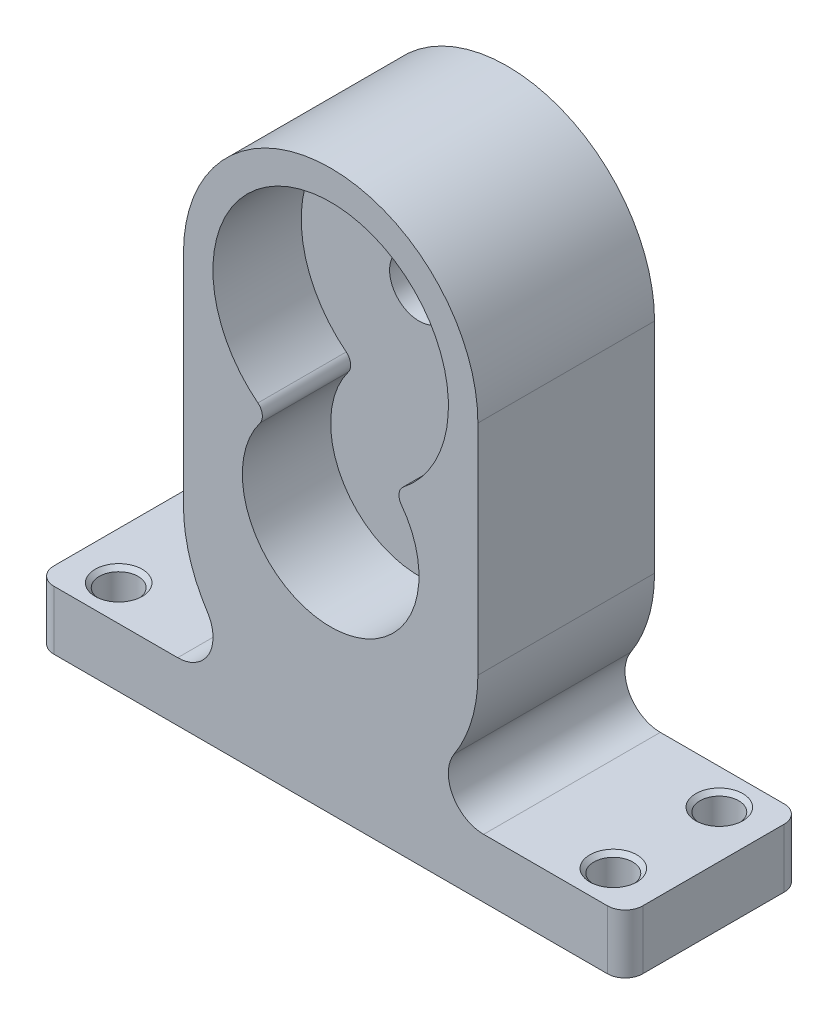
from build123d import *

# Parameters (mm, degrees)
EXTRUDE_1_DEPTH             = 30
FILLET_3_R                  = 6
FILLET_4_R                  = 6
SKETCH_2_R                  = 20
CUT_EXTRUDE_1_DEPTH         = 15
SKETCH_3_R                  = 5
CUT_EXTRUDE_2_DEPTH         = 112.467484048
SKETCH_4_R                  = 15
CUT_EXTRUDE_3_DEPTH         = 15
FILLET_5_R                  = 2
HOLE_WIZARD_M61_D           = 6.6
HOLE_WIZARD_M61_CSINK_D     = 8
HOLE_WIZARD_M61_CSINK_ANGLE = 90
PATTERN_LINEAR_2_COUNT      = 2
PATTERN_LINEAR_2_PITCH      = 18
PATTERN_LINEAR_2_COUNT_DIR2 = 2
PATTERN_LINEAR_2_PITCH_DIR2 = 84
FILLET_6_R                  = 3


with BuildPart() as part:
    # Эскиз1 → Бобышка-Вытянуть1 (new body)
    with BuildSketch(Plane.XY):
        with BuildLine():
            Line((0, 0), (0, 70))
            Line((0, 70), (0, 95))
            ThreePointArc((0, 95), (17.67766953, 87.67766953), (25, 70))
            Line((25, 70), (25, 32.912878475))
            ThreePointArc((25, 32.912878475), (20.916500663, 19.219814537), (10, 10))
            Line((10, 10), (50, 10))
            Line((50, 10), (50, 0))
            Line((50, 0), (0, 0))
        make_face()
    extrude_1 = extrude(amount=-EXTRUDE_1_DEPTH)

    # Зеркальное отражение1: Бобышка-Вытянуть1 across plane
    add(extrude_1.mirror(Plane(origin=(0, 0, 0), x_dir=(0, 0, 1), z_dir=(1, 0, 0))))

    # Скругление3
    fillet_3_edges = [part.edges().sort_by_distance(p)[0] for p in [
        (10, 10, -15),
    ]]
    fillet(fillet_3_edges, radius=FILLET_3_R)

    # Скругление4
    fillet_4_edges = [part.edges().sort_by_distance(p)[0] for p in [
        (-10, 10, -15),
    ]]
    fillet(fillet_4_edges, radius=FILLET_4_R)

    # Эскиз2 → Вырез-Вытянуть1 (cut)
    with BuildSketch(Plane.XY):
        with Locations((0, 70)):
            Circle(SKETCH_2_R)
    extrude(amount=-CUT_EXTRUDE_1_DEPTH, mode=Mode.SUBTRACT)

    # Эскиз3 → Вырез-Вытянуть2 (cut, through all)
    with BuildSketch(Plane.XY):
        with Locations((0, 70)):
            Circle(SKETCH_3_R)
    extrude(amount=-CUT_EXTRUDE_2_DEPTH, mode=Mode.SUBTRACT)

    # Эскиз4 → Вырез-Вытянуть3 (cut)
    with BuildSketch(Plane.XY):
        with Locations((0, 42.5)):
            Circle(SKETCH_4_R)
    extrude(amount=-CUT_EXTRUDE_3_DEPTH, mode=Mode.SUBTRACT)

    # Скругление5
    fillet_5_edges = [part.edges().sort_by_distance(p)[0] for p in [
        (10.644882952, 53.068181818, -7.5),
        (-10.644882952, 53.068181818, -7.5),
    ]]
    fillet(fillet_5_edges, radius=FILLET_5_R)

    # Зенковка для винта с полупотайной головкой M61 (through all)
    with Locations(Plane(origin=(0, 10, 0), x_dir=(1, 0, 0), z_dir=(0, 1, 0))):
        with Locations((42, 24)):
            hole_wizard_m61 = CounterSinkHole(HOLE_WIZARD_M61_D / 2, HOLE_WIZARD_M61_CSINK_D / 2, counter_sink_angle=HOLE_WIZARD_M61_CSINK_ANGLE)

    # Линейный массив2: Hole Wizard M61 2 × 2
    with Locations(*[(-j * PATTERN_LINEAR_2_PITCH_DIR2, 0, i * PATTERN_LINEAR_2_PITCH) for i in range(PATTERN_LINEAR_2_COUNT) for j in range(PATTERN_LINEAR_2_COUNT_DIR2) if (i, j) != (0, 0)]):
        add(hole_wizard_m61, mode=Mode.SUBTRACT)

    # Скругление6
    fillet_6_edges = [part.edges().sort_by_distance(p)[0] for p in [
        (50, 5, 0),
        (-50, 5, 0),
        (-50, 5, -30),
        (50, 5, -30),
    ]]
    fillet(fillet_6_edges, radius=FILLET_6_R)


solid = part.part
